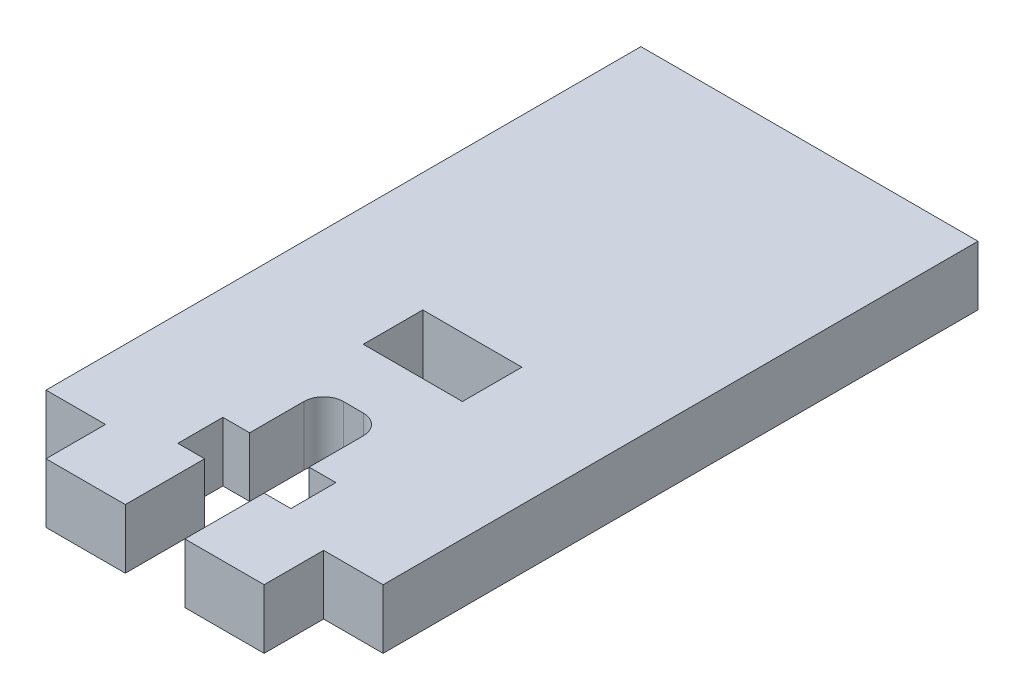
from build123d import *

# Parameters (mm, degrees)
SKETCH1_W               = 17
SKETCH1_H               = 30
BOSS_EXTRUDE1_DEPTH     = 1.5
SKETCH2_W               = 11
SKETCH2_H               = 3
BOSS_EXTRUDE2_DEPTH     = 1.5
CUT_EXTRUDE1_DEPTH      = 20.962464778
CUT_EXTRUDE1_DEPTH_BACK = 20.962464778
SKETCH3_W               = 5
SKETCH3_H               = 3
CUT_EXTRUDE2_DEPTH      = 20.962464778
CUT_EXTRUDE2_DEPTH_BACK = 20.962464778


with BuildPart() as part:
    # Sketch1 → Boss-Extrude1 (new, symmetric)
    with BuildSketch(Plane(origin=(0, 0, 0), x_dir=(1, 0, 0), z_dir=(0, 1, 0))):
        Rectangle(SKETCH1_W, SKETCH1_H)
    extrude(amount=BOSS_EXTRUDE1_DEPTH, both=True)

    # Sketch2 → Boss-Extrude2 (add, symmetric)
    with BuildSketch(Plane(origin=(0, 0, 0), x_dir=(1, 0, 0), z_dir=(0, 1, 0))):
        with Locations((0, -16.5)):
            Rectangle(SKETCH2_W, SKETCH2_H)
    extrude(amount=BOSS_EXTRUDE2_DEPTH, both=True)

    # Sketch3 → Cut-Extrude1 (cut, two sides: drawn at the far end of the back side and taken through both)
    with BuildSketch(Plane(origin=(0, 0, 0), x_dir=(1, 0, 0), z_dir=(0, 1, 0)).offset(-CUT_EXTRUDE1_DEPTH_BACK)):
        with Locations((0, -3.5)):
            Rectangle(SKETCH3_W, SKETCH3_H)
    extrude(amount=CUT_EXTRUDE1_DEPTH + CUT_EXTRUDE1_DEPTH_BACK, mode=Mode.SUBTRACT)

    # Sketch4 → Cut-Extrude2 (cut, two sides: drawn at the far end of the back side and taken through both)
    with BuildSketch(Plane(origin=(0, 0, 0), x_dir=(1, 0, 0), z_dir=(0, 1, 0)).offset(-CUT_EXTRUDE2_DEPTH_BACK)):
        with BuildLine():
            Line((-1.5, -18), (1.5, -18))
            Line((1.5, -18), (1.5, -14))
            Line((1.5, -14), (2.85, -14))
            Line((2.85, -14), (2.85, -11.73))
            Line((2.85, -11.73), (1.5, -11.73))
            Line((1.5, -11.73), (1.5, -9))
            ThreePointArc((1.5, -9), (1.207106781, -8.292893219), (0.5, -8))
            Line((0.5, -8), (-0.5, -8))
            ThreePointArc((-0.5, -8), (-1.207106781, -8.292893219), (-1.5, -9))
            Line((-1.5, -9), (-1.5, -11.73))
            Line((-1.5, -11.73), (-2.85, -11.73))
            Line((-2.85, -11.73), (-2.85, -14))
            Line((-2.85, -14), (-1.5, -14))
            Line((-1.5, -14), (-1.5, -18))
        make_face()
    extrude(amount=CUT_EXTRUDE2_DEPTH + CUT_EXTRUDE2_DEPTH_BACK, mode=Mode.SUBTRACT)


solid = part.part
